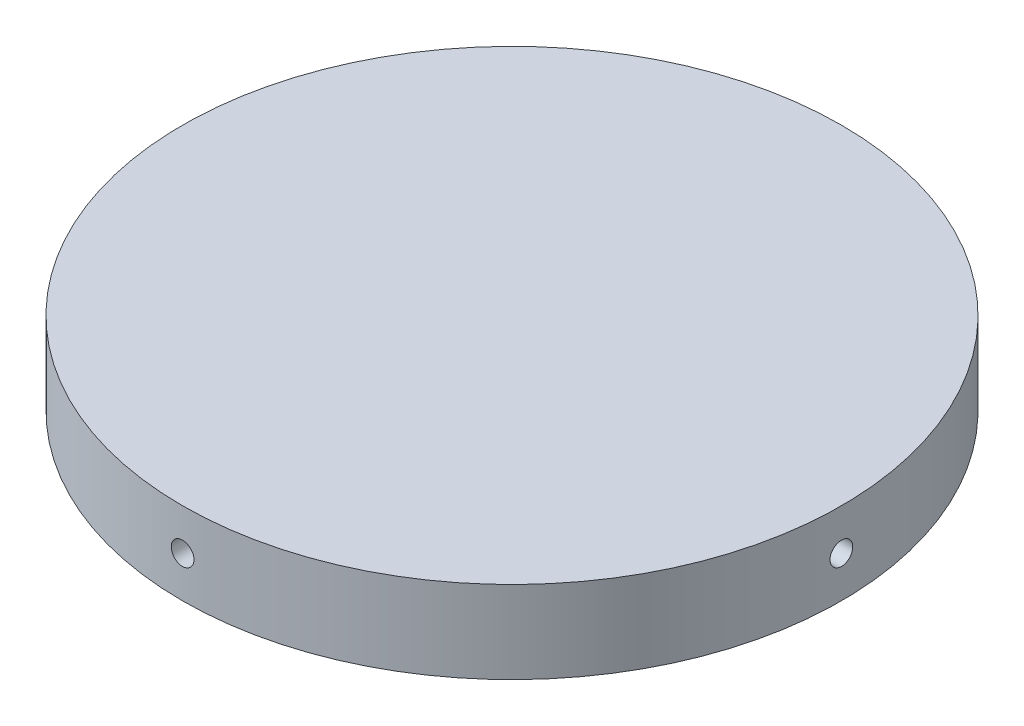
from build123d import *

# Parameters (mm, degrees)
SKETCH1_R           = 50.8
BOSS_EXTRUDE1_DEPTH = 12.7
SKETCH2_R           = 1.7526
CUT_EXTRUDE1_DEPTH  = 19.05
CIRPATTERN1_COUNT   = 4


with BuildPart() as part:
    # Sketch1 → Boss-Extrude1 (new body)
    with BuildSketch(Plane(origin=(0, 0, 0), x_dir=(1, 0, 0), z_dir=(0, 1, 0))):
        with Locations(Location((0, 0, 0), (0, 0, 270))):
            Circle(SKETCH1_R)
    extrude(amount=BOSS_EXTRUDE1_DEPTH)

    # Sketch2 → Cut-Extrude1 (cut)
    with BuildSketch(Plane.XY.offset(50.8)):
        with Locations((0, 6.35)):
            Circle(SKETCH2_R)
    cut_extrude1 = extrude(amount=-CUT_EXTRUDE1_DEPTH, mode=Mode.SUBTRACT)

    # CirPattern1: Cut-Extrude1 ×4 about axis
    cirpattern1_axis = Axis((0, 0, 0), (0, 1, 0))
    for i in range(1, CIRPATTERN1_COUNT):
        add(cut_extrude1.rotate(cirpattern1_axis, i * 360 / CIRPATTERN1_COUNT), mode=Mode.SUBTRACT)


solid = part.part
